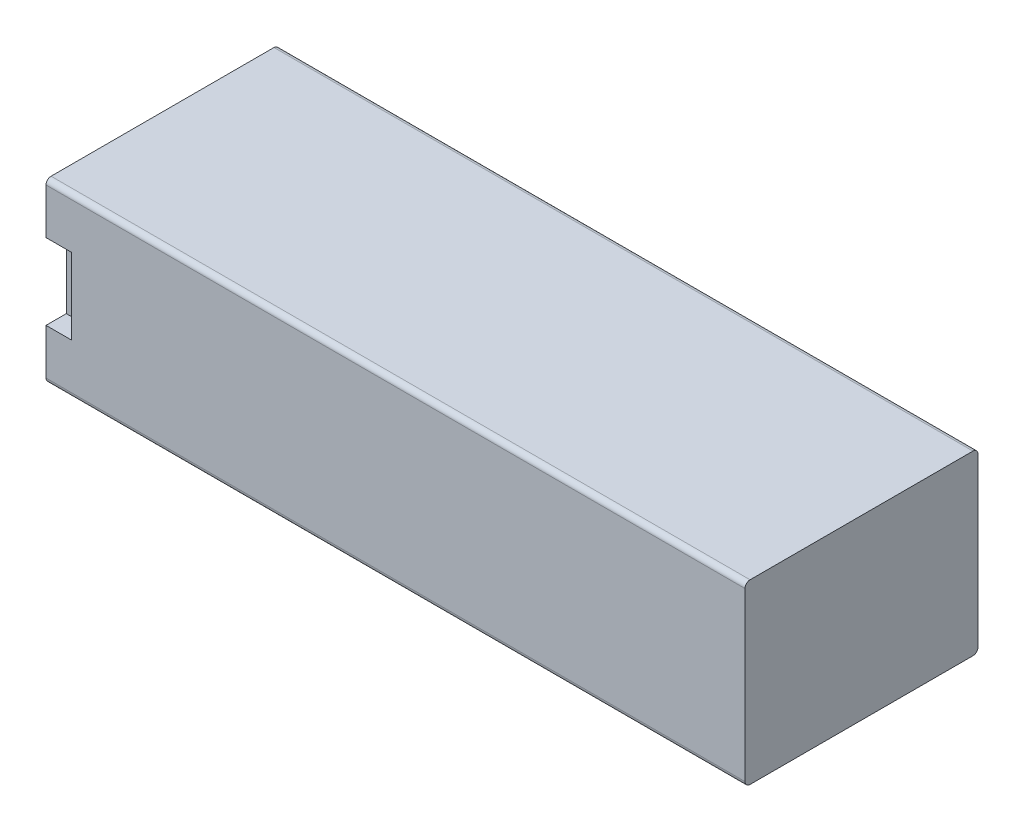
from build123d import *

# Parameters (mm, degrees)
SKETCH1_W           = 138
SKETCH1_H           = 35
BOSS_EXTRUDE1_DEPTH = 46
FILLET2_R           = 1
SKETCH4_W           = 4
SKETCH4_H           = 15
CUT_EXTRUDE2_DEPTH  = 5
FILLET3_R           = 2


with BuildPart() as part:
    # Sketch1 → Boss-Extrude1 (new body)
    with BuildSketch(Plane.XY):
        with Locations((69, 17.5)):
            Rectangle(SKETCH1_W, SKETCH1_H)
    extrude(amount=-BOSS_EXTRUDE1_DEPTH)

    # Fillet2
    fillet2_edges = [part.edges().sort_by_distance(p)[0] for p in [
        (69, 35, -46),
        (69, 35, 0),
        (69, 0, 0),
        (69, 0, -46),
    ]]
    fillet(fillet2_edges, radius=FILLET2_R)

    # Sketch4 → Cut-Extrude2 (cut)
    with BuildSketch(Plane.ZY):
        with Locations((-2, 17.5)):
            Rectangle(SKETCH4_W, SKETCH4_H)
    extrude(amount=-CUT_EXTRUDE2_DEPTH, mode=Mode.SUBTRACT)

    # Fillet3
    fillet3_edges = [part.edges().sort_by_distance(p)[0] for p in [
        (5, 17.5, -4),
    ]]
    fillet(fillet3_edges, radius=FILLET3_R)


solid = part.part
